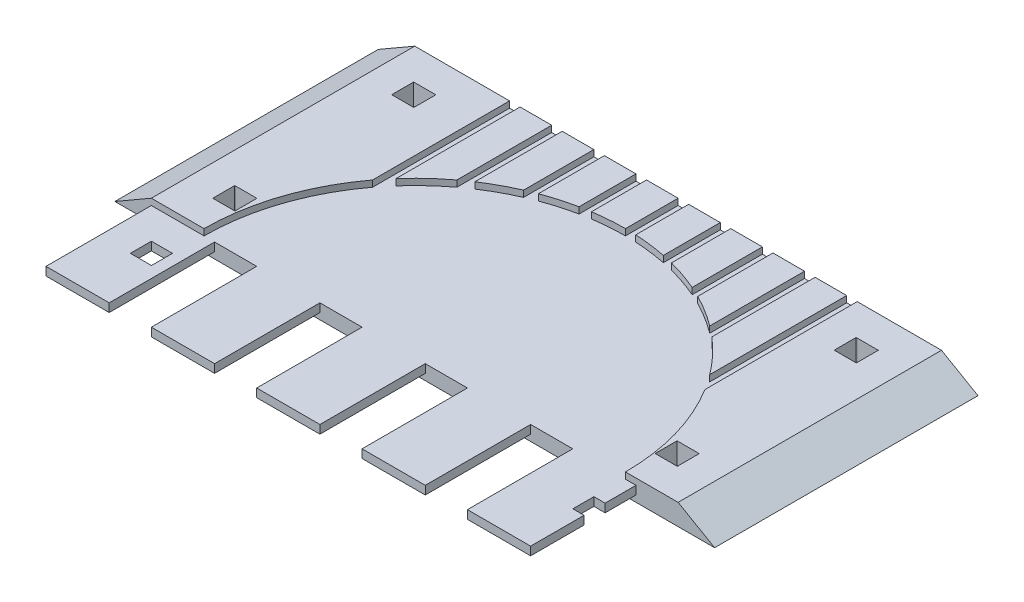
from build123d import *

# Parameters (mm, degrees)
SKETCH_1_W          = 250
SKETCH_1_H          = 125
EXTRUDE_1_DEPTH     = 10
SKETCH_5_W          = 10
SKETCH_5_H          = 10
CUT_EXTRUDE_1_DEPTH = 10
CUT_EXTRUDE_2_DEPTH = 3
SKETCH_8_W          = 30
SKETCH_8_H          = 4
EXTRUDE_2_DEPTH     = 50
SKETCH_11_W         = 10
SKETCH_11_H         = 10
CUT_EXTRUDE_4_DEPTH = 10
CUT_EXTRUDE_5_DEPTH = 3
EXTRUDE_3_DEPTH     = 125
SKETCH_14_W         = 30
SKETCH_14_H         = 69.595930906
CUT_EXTRUDE_6_DEPTH = 5
SKETCH_16_W         = 10.517397933
SKETCH_16_H         = 10.423374962
SKETCH_16_H_2       = 10.423374961
SKETCH_16_W_2       = 10.517397932
CUT_EXTRUDE_7_DEPTH = 190.684282477


with BuildPart() as part:
    # 草图1 → 凸台-拉伸1 (new body)
    with BuildSketch(Plane(origin=(0, 0, 0), x_dir=(1, 0, 0), z_dir=(0, 1, 0))):
        with Locations((0, 62.5)):
            Rectangle(SKETCH_1_W, SKETCH_1_H)
    extrude(amount=EXTRUDE_1_DEPTH)

    # 草图5 → 切除-拉伸1 (cut)
    with BuildSketch(Plane(origin=(0, 10, 0), x_dir=(1, 0, 0), z_dir=(0, 1, 0))):
        with Locations((-105, 105)):
            Rectangle(SKETCH_5_W, SKETCH_5_H)
        with Locations((-105, 20)):
            Rectangle(SKETCH_5_W, SKETCH_5_H)
        with Locations((105, 105)):
            Rectangle(SKETCH_5_W, SKETCH_5_H)
        with Locations((105, 20)):
            Rectangle(SKETCH_5_W, SKETCH_5_H)
    extrude(amount=-CUT_EXTRUDE_1_DEPTH, mode=Mode.SUBTRACT)

    # 草图6 → 切除-拉伸2 (cut)
    with BuildSketch(Plane(origin=(0, 10, 0), x_dir=(1, 0, 0), z_dir=(0, 1, 0))):
        with BuildLine():
            Line((-100, 0), (100, 0))
            ThreePointArc((100, 0), (0, 100), (-100, 0))
        make_face()
    extrude(amount=-CUT_EXTRUDE_2_DEPTH, mode=Mode.SUBTRACT)

    # 草图8 → 凸台-拉伸2 (add)
    with BuildSketch(Plane.XY):
        with Locations((-110, 5)):
            Rectangle(SKETCH_8_W, SKETCH_8_H)
        with Locations((-60, 5)):
            Rectangle(SKETCH_8_W, SKETCH_8_H)
        with Locations((-10, 5)):
            Rectangle(SKETCH_8_W, SKETCH_8_H)
        with Locations((40, 5)):
            Rectangle(SKETCH_8_W, SKETCH_8_H)
        with Locations((90, 5)):
            Rectangle(SKETCH_8_W, SKETCH_8_H)
    extrude(amount=EXTRUDE_2_DEPTH)

    # 草图11 → 切除-拉伸4 (cut)
    with BuildSketch(Plane(origin=(0, 10, 0), x_dir=(1, 0, 0), z_dir=(0, 1, 0))):
        Polygon((104.677013389, -14.646181821), (112.233893295, -14.646181821), (112.233893295, -24.646181821), (104.677013389, -24.646181821), (99.677013389, -24.646181821), (99.677013389, -14.646181821), align=None)
        with Locations((-105.322986611, -19.646181821)):
            Rectangle(SKETCH_11_W, SKETCH_11_H)
    extrude(amount=-CUT_EXTRUDE_4_DEPTH, mode=Mode.SUBTRACT)

    # 草图12 → 切除-拉伸5 (cut)
    with BuildSketch(Plane(origin=(0, 10, 0), x_dir=(1, 0, 0), z_dir=(0, 1, 0))):
        with BuildLine():
            Line((-80, 131.028694586), (-75, 131.028694586))
            Line((-75, 131.028694586), (-75, 66.143782777))
            ThreePointArc((-75, 66.143782777), (-77.560856859, 63.121418578), (-80, 60))
            Line((-80, 60), (-80, 131.028694586))
        make_face()
        with BuildLine():
            Line((85, 131.028694586), (85, 52.678268764))
            ThreePointArc((85, 52.678268764), (82.581183917, 56.394574765), (80, 60))
            Line((80, 60), (80, 131.028694586))
            Line((80, 131.028694586), (85, 131.028694586))
        make_face()
        with BuildLine():
            Line((65, 131.028694586), (65, 75.993420768))
            ThreePointArc((65, 75.993420768), (62.532097112, 78.036765891), (60, 80))
            Line((60, 80), (60, 131.028694586))
            Line((60, 131.028694586), (65, 131.028694586))
        make_face()
        with BuildLine():
            Line((45, 131.028694586), (45, 89.302855497))
            ThreePointArc((45, 89.302855497), (42.516221011, 90.511717202), (40, 91.651513899))
            Line((40, 91.651513899), (40, 131.028694586))
            Line((40, 131.028694586), (45, 131.028694586))
        make_face()
        with BuildLine():
            Line((25, 131.028694586), (25, 96.824583655))
            ThreePointArc((25, 96.824583655), (22.507410108, 97.434164903), (20, 97.979589711))
            Line((20, 97.979589711), (20, 131.028694586))
            Line((20, 131.028694586), (25, 131.028694586))
        make_face()
        with BuildLine():
            Line((5, 131.028694586), (5, 99.874921777))
            ThreePointArc((5, 99.874921777), (2.500782106, 99.968725554), (0, 100))
            Line((0, 100), (0, 131.028694586))
            Line((0, 131.028694586), (5, 131.028694586))
        make_face()
        with BuildLine():
            Line((-15, 131.028694586), (-15, 98.868599666))
            ThreePointArc((-15, 98.868599666), (-17.505644366, 98.455839925), (-20, 97.979589711))
            Line((-20, 97.979589711), (-20, 131.028694586))
            Line((-20, 131.028694586), (-15, 131.028694586))
        make_face()
        with BuildLine():
            Line((-35, 131.028694586), (-35, 93.674969976))
            ThreePointArc((-35, 93.674969976), (-37.513645432, 92.696960071), (-40, 91.651513899))
            Line((-40, 91.651513899), (-40, 131.028694586))
            Line((-40, 131.028694586), (-35, 131.028694586))
        make_face()
        with BuildLine():
            Line((-55, 131.028694586), (-55, 83.516465442))
            ThreePointArc((-55, 83.516465442), (-57.526875305, 81.796446241), (-60, 80))
            Line((-60, 80), (-60, 131.028694586))
            Line((-60, 131.028694586), (-55, 131.028694586))
        make_face()
    extrude(amount=-CUT_EXTRUDE_5_DEPTH, mode=Mode.SUBTRACT)

    # 草图13 → 凸台-拉伸3 (add)
    with BuildSketch(Plane(origin=(0, 0, -125), x_dir=(-1, 0, 0), z_dir=(0, 0, -1))):
        Polygon((125, 10), (125, 0), (142.320508076, 0), align=None)
        Polygon((-125, 10), (-125, 0), (-142.320508076, 0), align=None)
    extrude(amount=-EXTRUDE_3_DEPTH)

    # 草图14 → 切除-拉伸6 (cut)
    with BuildSketch(Plane.XZ):
        with Locations((-77.320508076, -90.202034547)):
            Rectangle(SKETCH_14_W, SKETCH_14_H)
        with Locations((-2.320508076, -90.202034547)):
            Rectangle(SKETCH_14_W, SKETCH_14_H)
        with Locations((72.679491924, -90.202034547)):
            Rectangle(SKETCH_14_W, SKETCH_14_H)
    extrude(amount=-CUT_EXTRUDE_6_DEPTH, mode=Mode.SUBTRACT)

    # 草图16 → 切除-拉伸7 (cut, through all)
    with BuildSketch(Plane(origin=(0, 10, 0), x_dir=(1, 0, 0), z_dir=(0, 1, 0))):
        with Locations((-105.258698967, 104.788312519)):
            Rectangle(SKETCH_16_W, SKETCH_16_H)
        with Locations((104.720979462, 19.822994084)):
            Rectangle(SKETCH_16_W, SKETCH_16_H_2)
        with Locations((-105.154924979, 19.775983857)):
            Rectangle(SKETCH_16_W_2, SKETCH_16_H)
        with Locations((104.744997222, 104.787129461)):
            Rectangle(SKETCH_16_W, SKETCH_16_H)
    extrude(amount=-CUT_EXTRUDE_7_DEPTH, mode=Mode.SUBTRACT)


solid = part.part
